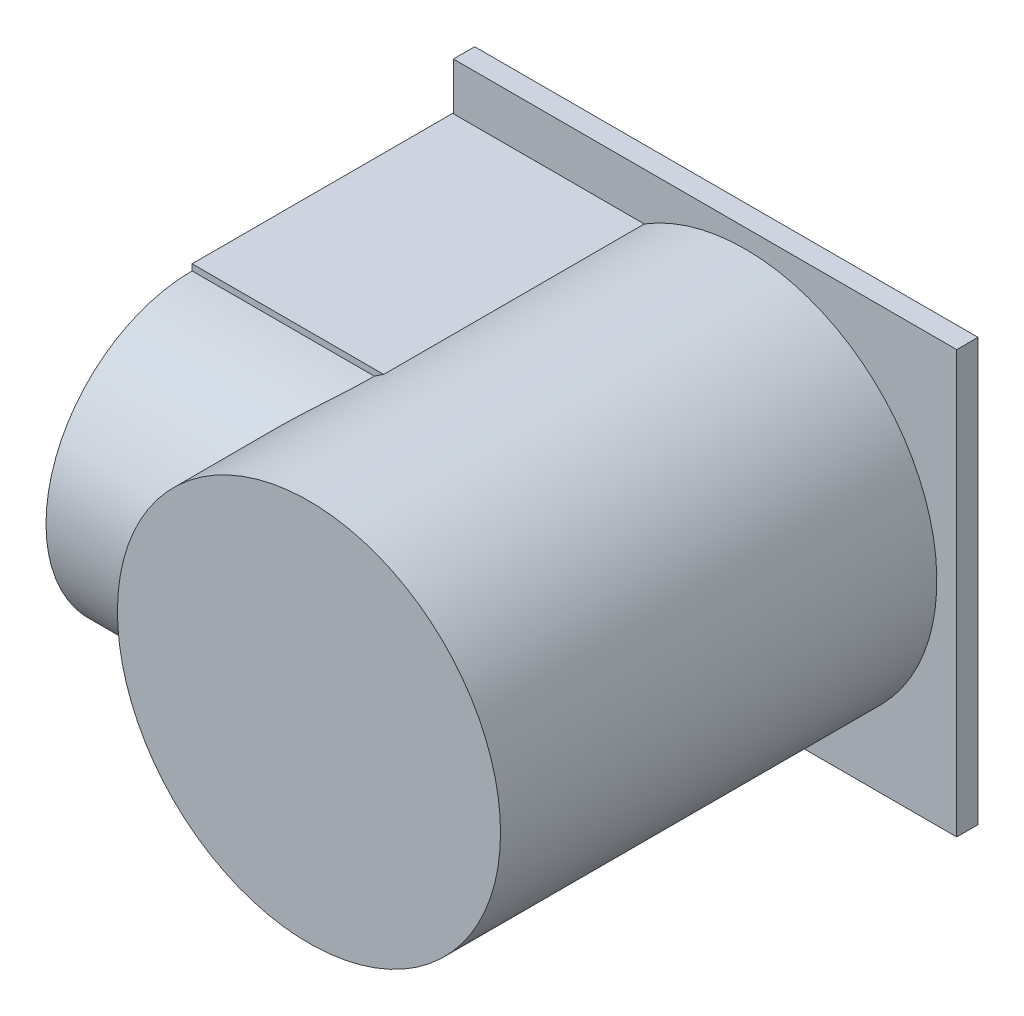
from build123d import *

# Parameters (mm, degrees)
SKETCH1_W           = 0.094600407
SKETCH1_H           = 0.079328796
SKETCH1_R           = 0.036000001
BOSS_EXTRUDE1_DEPTH = 0.004
SKETCH1_2_R         = 0.036000001
BOSS_EXTRUDE2_DEPTH = 0.086
BOSS_EXTRUDE3_DEPTH = 0.055


with BuildPart() as part:
    # Sketch1 → Boss-Extrude1 (new body)
    with BuildSketch(Plane.XY):
        with Locations((-0.00756472, -0.000164396)):
            Rectangle(SKETCH1_W, SKETCH1_H)
        Circle(SKETCH1_R, mode=Mode.SUBTRACT)
    extrude(amount=BOSS_EXTRUDE1_DEPTH)

    # Sketch1<2> → Boss-Extrude2 (add)
    with BuildSketch(Plane.XY):
        Circle(SKETCH1_2_R)
    extrude(amount=BOSS_EXTRUDE2_DEPTH)

    # Sketch2 → Boss-Extrude3 (add)
    with BuildSketch(Plane(origin=(0, 0, 0), x_dir=(0, 0, -1), z_dir=(1, 0, 0))):
        with BuildLine():
            Line((-0.052977393, -0.025474995), (-0.052977393, -0.026637747))
            Line((-0.052977393, -0.026637747), (0, -0.026637747))
            Line((0, -0.026637747), (0, 0.030589564))
            Line((0, 0.030589564), (-0.052977393, 0.030589564))
            Line((-0.052977393, 0.030589564), (-0.052977393, 0.029426813))
            ThreePointArc((-0.052977393, 0.029426813), (-0.080428298, 0.001975909), (-0.052977393, -0.025474995))
        make_face()
    extrude(amount=-BOSS_EXTRUDE3_DEPTH)


solid = part.part
